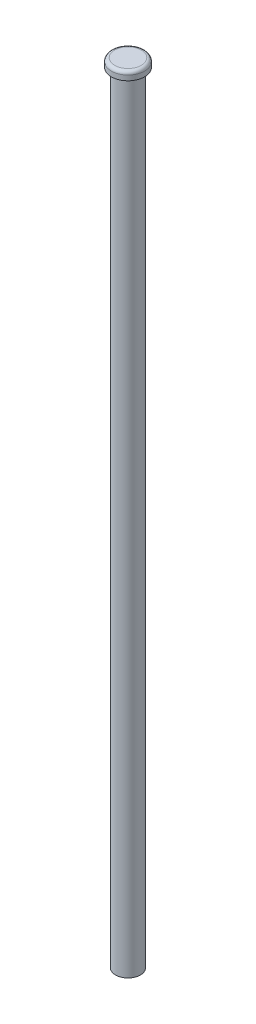
from build123d import *

# Parameters (mm, degrees)
SKETCH1_R           = 1.5
BOSS_EXTRUDE1_DEPTH = 94
SKETCH2_R           = 2
BOSS_EXTRUDE2_DEPTH = 1
FILLET1_R           = 0.4


with BuildPart() as part:
    # Sketch1 → Boss-Extrude1 (new body)
    with BuildSketch(Plane(origin=(0, 0, 0), x_dir=(1, 0, 0), z_dir=(0, 1, 0))):
        with Locations(Location((0, 0, 0), (0, 0, 270))):
            Circle(SKETCH1_R)
    extrude(amount=BOSS_EXTRUDE1_DEPTH)

    # Sketch2 → Boss-Extrude2 (add)
    with BuildSketch(Plane(origin=(0, 94, 0), x_dir=(1, 0, 0), z_dir=(0, 1, 0))):
        with Locations(Location((0, 0, 0), (0, 0, 270))):
            Circle(SKETCH2_R)
    extrude(amount=BOSS_EXTRUDE2_DEPTH)

    # Fillet1
    fillet1_edges = [part.edges().sort_by_distance(p)[0] for p in [
        (0, 95, -2),
    ]]
    fillet(fillet1_edges, radius=FILLET1_R)


solid = part.part
